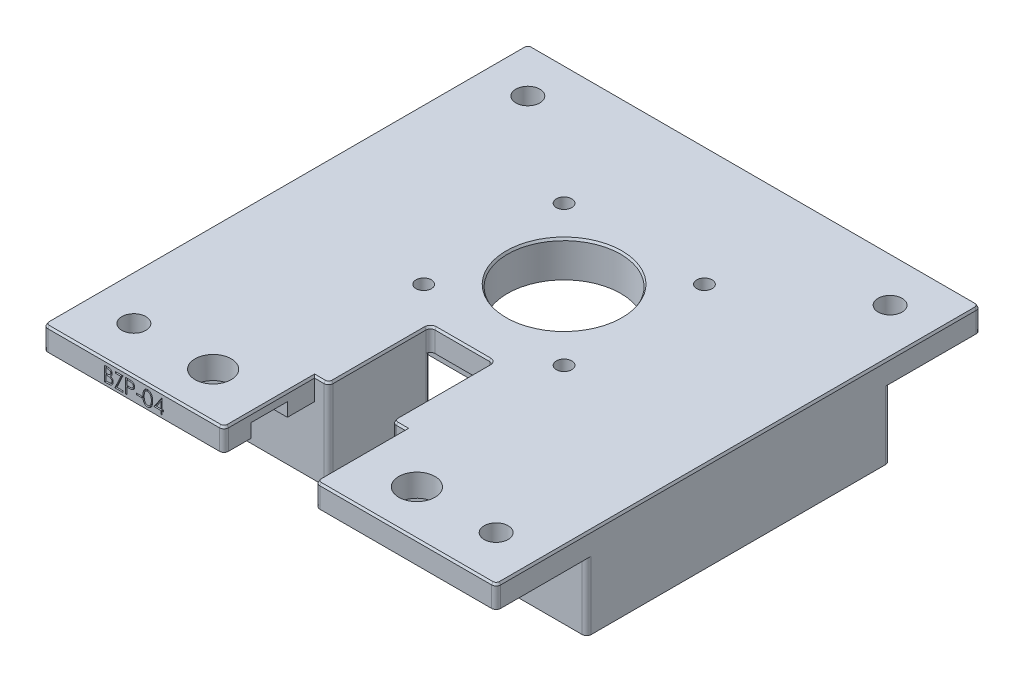
from build123d import *
from OCP.BRepFilletAPI import BRepFilletAPI_MakeChamfer
from build123d.topology import SkipClean

# Parameters (mm, degrees)
SKETCH2_W                  = 100
SKETCH2_H                  = 107
BOSS_EXTRUDE1_DEPTH        = 5
CUT_EXTRUDE1_DEPTH         = 147.540096902
CUT_EXTRUDE1_DEPTH_BACK    = 147.540096902
SKETCH3_R                  = 12.5
SKETCH3_R_2                = 1.7
SKETCH3_R_3                = 4
M5_CLEARANCE_HOLE1_D       = 5.3
FILLET1_R                  = 1
BOSS_EXTRUDE2_DEPTH        = 15
FILLET3_R                  = 3
FILLET4_R                  = 1
CUT_EXTRUDE2_DEPTH         = 4
CUT_EXTRUDE2_DEPTH_BACK    = 4
SKETCH12_R                 = 12.5
SKETCH12_R_2               = 1.7
BOSS_EXTRUDE3_DEPTH        = 3
CHAMFER2_SIZE              = 0.5
SKETCH10_W                 = 1.221153846
SKETCH10_H                 = 0.325641026
PART_NUM_DEPTH             = 0.4
PRINTABILITY_CHAMFER_SIZE  = 0.5
PRINTABILITY_CHAMFER_SIZE2 = 0.288675135


with BuildPart() as part:
    # Sketch2 → Boss-Extrude1 (new body)
    with BuildSketch(Plane(origin=(0, 0, 0), x_dir=(1, 0, 0), z_dir=(0, 1, 0))):
        with Locations((50, 53.5)):
            Rectangle(SKETCH2_W, SKETCH2_H)
    extrude(amount=BOSS_EXTRUDE1_DEPTH)

    # Sketch3 → Cut-Extrude1 (cut, two sides: drawn at the far end of the back side and taken through both)
    with BuildSketch(Plane(origin=(0, 5, 0), x_dir=(1, 0, 0), z_dir=(0, 1, 0)).offset(-CUT_EXTRUDE1_DEPTH_BACK)):
        with Locations(Location((50, 65, 0), (0, 0, 270))):
            Circle(SKETCH3_R)
        with Locations(Location((65.5, 49.5, 0), (0, 0, 270))):
            Circle(SKETCH3_R_2)
        with Locations(Location((34.5, 49.5, 0), (0, 0, 270))):
            Circle(SKETCH3_R_2)
        with Locations(Location((65.5, 80.5, 0), (0, 0, 270))):
            Circle(SKETCH3_R_2)
        with Locations(Location((34.5, 80.5, 0), (0, 0, 270))):
            Circle(SKETCH3_R_2)
        with Locations(Location((27.5, 10, 0), (0, 0, 270))):
            Circle(SKETCH3_R_3)
        with Locations(Location((72.5, 10, 0), (0, 0, 90))):
            Circle(SKETCH3_R_3)
        Polygon((39.9, 0), (39.9, 20), (43, 20), (43, 42.5), (57, 42.5), (57, 20), (60.1, 20), (60.1, 0), align=None)
    extrude(amount=CUT_EXTRUDE1_DEPTH + CUT_EXTRUDE1_DEPTH_BACK, mode=Mode.SUBTRACT)

    # M5 Clearance Hole1 (through all)
    with Locations(Plane(origin=(0, 5, 0), x_dir=(1, 0, 0), z_dir=(0, 1, 0))):
        with Locations((10, 97), (10, 10), (90, 10), (90, 97)):
            Hole(M5_CLEARANCE_HOLE1_D / 2)

    # Fillet1
    fillet1_edges = [part.edges().sort_by_distance(p)[0] for p in [
        (60.1, 2.5, 0),
        (39.9, 2.5, 0),
        (43, 2.5, -42.5),
        (57, 2.5, -42.5),
        (0, 2.5, -107),
        (100, 2.5, -107),
        (100, 2.5, 0),
        (0, 2.5, 0),
    ]]
    fillet(fillet1_edges, radius=FILLET1_R)

    # Sketch7 → Boss-Extrude2 (add)
    with BuildSketch(Plane.XZ):
        Polygon((57, -20), (100, -20), (100, -87), (84, -87), (84, -82), (95, -82), (95, -25), (62, -25), (62, -42.5), (57, -42.5), (57, -25), align=None)
        Polygon((43, -25), (43, -20), (0, -20), (0, -87), (16, -87), (16, -82), (5, -82), (5, -25), (38, -25), (38, -42.5), (43, -42.5), align=None)
    extrude(amount=BOSS_EXTRUDE2_DEPTH)

    # Fillet3
    fillet3_edges = [part.edges().sort_by_distance(p)[0] for p in [
        (62, -7.5, -25),
        (95, -7.5, -25),
        (95, -7.5, -82),
        (5, -7.5, -82),
        (5, -7.5, -25),
        (38, -7.5, -25),
    ]]
    fillet(fillet3_edges, radius=FILLET3_R)

    # Fillet4
    fillet4_edges = [part.edges().sort_by_distance(p)[0] for p in [
        (100, -7.5, -87),
        (100, -7.5, -20),
        (43, -5, -20),
        (57, -5, -20),
        (84, -7.5, -87),
        (84, -7.5, -82),
        (0, -7.5, -20),
        (0, -7.5, -87),
        (16, -7.5, -87),
        (16, -7.5, -82),
        (38, -7.5, -42.5),
        (62, -7.5, -42.5),
        (57, -7.5, -42.5),
        (43, -7.5, -42.5),
    ]]
    fillet(fillet4_edges, radius=FILLET4_R)

    # Sketch9 → Cut-Extrude2 (cut, two sides: drawn at the far end of the back side and taken through both)
    with BuildSketch(Plane.XY.offset(-10).offset(-CUT_EXTRUDE2_DEPTH_BACK)):
        Polygon((39.9, 0), (39.9, 3), (36.9, 0), align=None)
        Polygon((60.1, 0), (63.1, 0), (60.1, 3), align=None)
    extrude(amount=CUT_EXTRUDE2_DEPTH + CUT_EXTRUDE2_DEPTH_BACK, mode=Mode.SUBTRACT)

    # Sketch12 → Boss-Extrude3 (add)
    with SkipClean():  # the faces are left unmerged after this step: merging them gives an invalid solid
        with BuildSketch(Plane.XZ):
            with BuildLine():
                Line((34.5, -85.5), (65.5, -85.5))
                ThreePointArc((65.5, -85.5), (69.035533906, -84.035533906), (70.5, -80.5))
                Line((70.5, -80.5), (70.5, -49.5))
                ThreePointArc((70.5, -49.5), (69.035533906, -45.964466094), (65.5, -44.5))
                Line((65.5, -44.5), (34.5, -44.5))
                ThreePointArc((34.5, -44.5), (30.964466094, -45.964466094), (29.5, -49.5))
                Line((29.5, -49.5), (29.5, -80.5))
                ThreePointArc((29.5, -80.5), (30.964466094, -84.035533906), (34.5, -85.5))
            make_face()
            with Locations(Location((50, -65, 0), (0, 0, 270))):
                Circle(SKETCH12_R, mode=Mode.SUBTRACT)
            with Locations(Location((34.5, -49.5, 0), (0, 0, 270))):
                Circle(SKETCH12_R_2, mode=Mode.SUBTRACT)
            with Locations(Location((65.5, -49.5, 0), (0, 0, 270))):
                Circle(SKETCH12_R_2, mode=Mode.SUBTRACT)
            with Locations(Location((65.5, -80.5, 0), (0, 0, 270))):
                Circle(SKETCH12_R_2, mode=Mode.SUBTRACT)
            with Locations(Location((34.5, -80.5, 0), (0, 0, 270))):
                Circle(SKETCH12_R_2, mode=Mode.SUBTRACT)
        extrude(amount=BOSS_EXTRUDE3_DEPTH)

    # Chamfer2
    chamfer2_edges = [part.edges().sort_by_distance(p)[0] for p in [
        (69.035533906, 0, -84.035533906),
        (70.5, 0, -65),
        (69.035533906, 0, -45.964466094),
        (50, 0, -44.5),
        (30.964466094, 0, -45.964466094),
        (29.5, 0, -65),
        (30.964466094, 0, -84.035533906),
        (50, 0, -85.5),
    ]]
    chamfer(chamfer2_edges, length=CHAMFER2_SIZE)

    # Sketch10 → Part Num (cut)
    # profile 1 of 6: a face of its own
    with SkipClean():  # the faces are left unmerged after this step: merging them gives an invalid solid
        with BuildSketch(Plane(origin=(0, 5, 0), x_dir=(1, 0, 0), z_dir=(0, 0, -1))):
            with BuildLine():
                Line((13.559294872, 1.225), (14.178776042, 1.225))
                add(Edge.make_bspline(
                    [(14.178776042, 1.225), (14.209100925, 1.225156921), (14.267878096, 1.225461072), (14.353342091, 1.230287737), (14.433418884, 1.236704332), (14.50796697, 1.247467824), (14.577471422, 1.258628146), (14.641226624, 1.275008826), (14.699766605, 1.293101885), (14.77006114, 1.32094051), (14.849819923, 1.364174247), (14.93554569, 1.428293986), (15.010063757, 1.505168377), (15.073426203, 1.592772808), (15.124275913, 1.68914761), (15.160598035, 1.792219247), (15.18393275, 1.900253662), (15.186302411, 1.974321243), (15.1875, 2.011753806)],
                    knots=[0, 0, 0, 0, 1.00128172, 1.940733171, 2.826250472, 3.653024905, 4.427672124, 5.149348099, 5.824709082, 6.450061444, 7.643590664, 8.808605388, 9.972104426, 11.165284501, 12.367876273, 13.557044126, 14.765369432, 16, 16, 16, 16], degree=3))
                add(Edge.make_bspline(
                    [(15.1875, 2.011753806), (15.186521793, 2.046821674), (15.184599523, 2.115733341), (15.165820503, 2.216186738), (15.137474028, 2.312110727), (15.096568342, 2.402580893), (15.044410156, 2.486802276), (14.980951884, 2.563338275), (14.905707767, 2.630686236), (14.849214068, 2.668166335), (14.820517829, 2.687204527)],
                    knots=[0, 0, 0, 0, 1.044356178, 2.052258378, 3.035953355, 4.020338374, 5.002448483, 5.980768927, 6.974322109, 8, 8, 8, 8], degree=3))
                add(Edge.make_bspline(
                    [(14.820517829, 2.687204527), (14.856588776, 2.701045853), (14.925601434, 2.727527739), (15.020694663, 2.77452874), (15.102651573, 2.825257679), (15.172528364, 2.880086384), (15.231080178, 2.940805168), (15.283240485, 3.005814962), (15.327507334, 3.077379834), (15.365276832, 3.153949009), (15.395196276, 3.235117005), (15.415964531, 3.320276589), (15.429135825, 3.40846321), (15.430858211, 3.468399436), (15.431730769, 3.498763021)],
                    knots=[0, 0, 0, 0, 1.272200328, 2.434034374, 3.488177493, 4.442517805, 5.351202203, 6.260825393, 7.183200622, 8.11705787, 9.069326169, 10.026320267, 11.000137371, 12, 12, 12, 12], degree=3))
                add(Edge.make_bspline(
                    [(15.431730769, 3.498763021), (15.430844545, 3.529757203), (15.429100875, 3.590739126), (15.41623883, 3.680324877), (15.394454675, 3.765933729), (15.364470848, 3.848135531), (15.325385419, 3.926448851), (15.27816616, 4.001489144), (15.22149309, 4.072144303), (15.157673639, 4.13943962), (15.086469492, 4.20097828), (15.008008094, 4.253862582), (14.924300327, 4.299540927), (14.834199915, 4.336263754), (14.73834618, 4.365011011), (14.636716669, 4.384886817), (14.529369089, 4.398332925), (14.455699174, 4.399434879), (14.41791867, 4.4)],
                    knots=[0, 0, 0, 0, 0.978522333, 1.925270105, 2.85076145, 3.763600118, 4.682725947, 5.609499657, 6.557784645, 7.537954401, 8.534920712, 9.522742111, 10.520247711, 11.5409147, 12.58930695, 13.675078472, 14.807699069, 16, 16, 16, 16], degree=3))
                Line((14.41791867, 4.4), (13.559294872, 4.4))
                Line((13.559294872, 4.4), (13.559294872, 1.225))
            make_face()
            with BuildLine():
                Line((13.844230769, 1.550641026), (13.844230769, 2.568269231))
                Line((13.844230769, 2.568269231), (14.035672075, 2.568269231))
                add(Edge.make_bspline(
                    [(14.035672075, 2.568269231), (14.063656592, 2.567909462), (14.11772838, 2.567214317), (14.196240951, 2.565160292), (14.26893695, 2.559660798), (14.336066859, 2.553844164), (14.397180797, 2.544887778), (14.452483186, 2.53392756), (14.502471365, 2.522437825), (14.560090796, 2.502841292), (14.625441111, 2.474182831), (14.694618633, 2.428618136), (14.756881512, 2.375864071), (14.808244794, 2.313289506), (14.85100659, 2.245714635), (14.879796447, 2.172635549), (14.899869806, 2.096570575), (14.901656804, 2.044112234), (14.902564103, 2.017477965)],
                    knots=[0, 0, 0, 0, 1.156584208, 2.234756387, 3.244705828, 4.168772894, 5.018724976, 5.795346628, 6.498686023, 7.135894168, 8.308330183, 9.43588092, 10.547699294, 11.667188675, 12.76860303, 13.837480448, 14.902040606, 16, 16, 16, 16], degree=3))
                add(Edge.make_bspline(
                    [(14.902564103, 2.017477965), (14.902121598, 1.999845497), (14.901253578, 1.965257486), (14.893070408, 1.914864741), (14.88177773, 1.866910763), (14.863153292, 1.822688306), (14.841088146, 1.780644538), (14.8128059, 1.742107543), (14.780193868, 1.706033348), (14.742172327, 1.673388889), (14.698896699, 1.64386386), (14.648996117, 1.619285683), (14.593827254, 1.597443357), (14.532239669, 1.580886362), (14.465460128, 1.566512255), (14.392469815, 1.557448022), (14.313708618, 1.551625016), (14.259137987, 1.550976338), (14.230929487, 1.550641026)],
                    knots=[0, 0, 0, 0, 0.911412742, 1.787835618, 2.63643285, 3.453173233, 4.262886967, 5.08783453, 5.918594724, 6.773969545, 7.67442701, 8.62112486, 9.645634318, 10.739428598, 11.916091468, 13.177237585, 14.540865421, 16, 16, 16, 16], degree=3))
                Line((14.230929487, 1.550641026), (13.844230769, 1.550641026))
            make_face(mode=Mode.SUBTRACT)
            with BuildLine():
                Line((13.844230769, 2.893910256), (13.844230769, 4.074358974))
                Line((13.844230769, 4.074358974), (14.250010016, 4.074358974))
                add(Edge.make_bspline(
                    [(14.250010016, 4.074358974), (14.279052852, 4.073977387), (14.335029091, 4.073241928), (14.415910647, 4.071496784), (14.490477252, 4.065022306), (14.55934975, 4.058814977), (14.622209475, 4.048674015), (14.679667845, 4.038854064), (14.730412484, 4.024403522), (14.789786642, 4.00451932), (14.856196042, 3.97274173), (14.92871824, 3.926010062), (14.99259521, 3.869087446), (15.046790344, 3.803544285), (15.091851221, 3.733014359), (15.123024449, 3.657358853), (15.143222926, 3.579104783), (15.145601826, 3.52559752), (15.146794872, 3.498763021)],
                    knots=[0, 0, 0, 0, 1.16016216, 2.236059617, 3.229676189, 4.14889023, 4.996733752, 5.772278665, 6.474820656, 7.101410824, 8.271817372, 9.403828207, 10.537358096, 11.673541442, 12.791884111, 13.865947414, 14.929748409, 16, 16, 16, 16], degree=3))
                add(Edge.make_bspline(
                    [(15.146794872, 3.498763021), (15.146551335, 3.481984403), (15.146068189, 3.448697807), (15.138473614, 3.399825141), (15.127934288, 3.352248989), (15.11240228, 3.306615593), (15.093612775, 3.262139153), (15.06882463, 3.220266851), (15.040863787, 3.17921625), (14.997556668, 3.126707986), (14.933707118, 3.066939881), (14.842942728, 3.009154389), (14.740317485, 2.961797377), (14.665709188, 2.941777202), (14.62716847, 2.931435296)],
                    knots=[0, 0, 0, 0, 0.723354195, 1.435040621, 2.129761981, 2.824182007, 3.512608497, 4.209435533, 4.920062464, 5.654614313, 7.143585817, 8.671381114, 10.280521501, 12, 12, 12, 12], degree=3))
                add(Edge.make_bspline(
                    [(14.62716847, 2.931435296), (14.611720661, 2.928300831), (14.578226627, 2.921504664), (14.523609473, 2.914335298), (14.461047138, 2.907904144), (14.390807025, 2.903271916), (14.31260978, 2.898299301), (14.226480524, 2.896434267), (14.132358367, 2.894157894), (14.067050921, 2.893994914), (14.033128005, 2.893910256)],
                    knots=[0, 0, 0, 0, 0.634452549, 1.375623993, 2.216454381, 3.166361212, 4.209414599, 5.370755378, 6.634280627, 8, 8, 8, 8], degree=3))
                Line((14.033128005, 2.893910256), (13.844230769, 2.893910256))
            make_face(mode=Mode.SUBTRACT)
        # profile 2 of 6: a face of its own
        with BuildSketch(Plane(origin=(0, 5, 0), x_dir=(1, 0, 0), z_dir=(0, 0, -1))):
            Polygon((15.920192308, 1.550641026), (15.920192308, 1.225), (17.589102564, 1.225), (16.257281651, 4.074358974), (17.548397436, 4.074358974), (17.548397436, 4.4), (15.798076923, 4.4), (17.129897837, 1.550641026), align=None)
        # profile 3 of 6: a face of its own
        with BuildSketch(Plane(origin=(0, 5, 0), x_dir=(1, 0, 0), z_dir=(0, 0, -1))):
            with BuildLine():
                Line((18.199679487, 1.225), (18.822340745, 1.225))
                add(Edge.make_bspline(
                    [(18.822340745, 1.225), (18.865167781, 1.225047077), (18.947226285, 1.22513728), (19.064896371, 1.227872085), (19.171766628, 1.23152487), (19.267606616, 1.236588444), (19.352711219, 1.242572494), (19.426695341, 1.250965415), (19.49014051, 1.259728683), (19.528155646, 1.268638102), (19.545492788, 1.272701322)],
                    knots=[0, 0, 0, 0, 1.415646017, 2.712440637, 3.8905458, 4.950247383, 5.884950622, 6.709939814, 7.411656543, 8, 8, 8, 8], degree=3))
                add(Edge.make_bspline(
                    [(19.545492788, 1.272701322), (19.56743964, 1.278708558), (19.610816194, 1.290581476), (19.673321301, 1.314358446), (19.732780513, 1.342564145), (19.789442546, 1.374662729), (19.842336712, 1.412170044), (19.89311447, 1.452921295), (19.940710937, 1.498564559), (19.984407421, 1.549039743), (20.024894101, 1.6026933), (20.058784353, 1.660893367), (20.08871078, 1.721620959), (20.112032716, 1.78635876), (20.130364655, 1.854252238), (20.143715825, 1.9254781), (20.152296908, 1.999882695), (20.153111145, 2.050738752), (20.153525641, 2.076627604)],
                    knots=[0, 0, 0, 0, 0.999333726, 1.975119402, 2.933498163, 3.889020618, 4.832249799, 5.779334906, 6.747801194, 7.724875447, 8.710438469, 9.696133548, 10.679360639, 11.681339199, 12.714023775, 13.766351759, 14.862936069, 16, 16, 16, 16], degree=3))
                add(Edge.make_bspline(
                    [(20.153525641, 2.076627604), (20.153143349, 2.102733159), (20.152395368, 2.15381044), (20.143418023, 2.228534326), (20.131325635, 2.299943151), (20.11273188, 2.367878582), (20.08837902, 2.431937173), (20.059811229, 2.493097862), (20.025354741, 2.550320136), (19.985762645, 2.603811736), (19.941719413, 2.65362287), (19.893411391, 2.699392577), (19.841033604, 2.740852941), (19.784752512, 2.77809691), (19.724019435, 2.810260821), (19.659755482, 2.839069233), (19.591402071, 2.863263695), (19.544101362, 2.875990965), (19.520052083, 2.882461939)],
                    knots=[0, 0, 0, 0, 1.121902311, 2.195077645, 3.232258892, 4.234102512, 5.217864754, 6.176164875, 7.132989551, 8.084763148, 9.034132444, 9.988522005, 10.94243251, 11.903244335, 12.886203696, 13.894208494, 14.929344452, 16, 16, 16, 16], degree=3))
                add(Edge.make_bspline(
                    [(19.520052083, 2.882461939), (19.500160632, 2.886688777), (19.456567361, 2.895952137), (19.384778108, 2.906363894), (19.301151672, 2.914902673), (19.205972588, 2.922871129), (19.0990189, 2.927093415), (18.980535909, 2.932051068), (18.850122628, 2.934390313), (18.759163431, 2.934538182), (18.711673678, 2.934615385)],
                    knots=[0, 0, 0, 0, 0.601372724, 1.317943291, 2.144091499, 3.08771165, 4.142394186, 5.309582461, 6.595334295, 8, 8, 8, 8], degree=3))
                Line((18.711673678, 2.934615385), (18.484615385, 2.934615385))
                Line((18.484615385, 2.934615385), (18.484615385, 4.4))
                Line((18.484615385, 4.4), (18.199679487, 4.4))
                Line((18.199679487, 4.4), (18.199679487, 1.225))
            make_face()
            with BuildLine():
                Line((18.484615385, 1.550641026), (18.484615385, 2.608974359))
                Line((18.484615385, 2.608974359), (19.040494792, 2.615970553))
                add(Edge.make_bspline(
                    [(19.040494792, 2.615970553), (19.067636896, 2.61598845), (19.120034167, 2.616022999), (19.195928006, 2.61234584), (19.266170464, 2.608345506), (19.330865252, 2.601876016), (19.389717084, 2.593985255), (19.44286845, 2.583435268), (19.490743523, 2.572674962), (19.545890306, 2.554003923), (19.607660485, 2.525836289), (19.674703005, 2.483764418), (19.73198534, 2.430764439), (19.781136336, 2.370529413), (19.81998684, 2.303449897), (19.848143485, 2.231877993), (19.865329717, 2.156085468), (19.86748988, 2.104277864), (19.868589744, 2.077899639)],
                    knots=[0, 0, 0, 0, 1.160501667, 2.240324542, 3.248665471, 4.168823117, 5.020172044, 5.786515869, 6.485785279, 7.116517804, 8.272762037, 9.381837012, 10.485674779, 11.594342068, 12.695271952, 13.786226926, 14.872841088, 16, 16, 16, 16], degree=3))
                add(Edge.make_bspline(
                    [(19.868589744, 2.077899639), (19.867440811, 2.052375996), (19.865156875, 2.001638153), (19.84828545, 1.927242072), (19.819688653, 1.856483828), (19.781104663, 1.789935981), (19.733131498, 1.729861051), (19.67698839, 1.678042247), (19.613548837, 1.636100993), (19.554996767, 1.608181099), (19.502597275, 1.591808252), (19.457302681, 1.579987886), (19.405900244, 1.571835631), (19.348876426, 1.564035455), (19.286304234, 1.557739017), (19.217785787, 1.553366568), (19.143549316, 1.550834445), (19.092014254, 1.55070706), (19.065299479, 1.550641026)],
                    knots=[0, 0, 0, 0, 1.12039168, 2.227199994, 3.330242575, 4.460839274, 5.593542475, 6.693949254, 7.801736126, 8.92216649, 9.528704869, 10.210659466, 10.975987387, 11.81211542, 12.738540127, 13.736887663, 14.826846554, 16, 16, 16, 16], degree=3))
                Line((19.065299479, 1.550641026), (18.484615385, 1.550641026))
            make_face(mode=Mode.SUBTRACT)
        # profile 4 of 6: a face of its own
        with BuildSketch(Plane(origin=(0, 5, 0), x_dir=(1, 0, 0), z_dir=(0, 0, -1))):
            with Locations((21.130448718, 3.178846154)):
                Rectangle(SKETCH10_W, SKETCH10_H)
        # profile 5 of 6: a face of its own
        with BuildSketch(Plane(origin=(0, 5, 0), x_dir=(1, 0, 0), z_dir=(0, 0, -1))):
            with BuildLine():
                add(Edge.make_bspline(
                    [(21.98525641, 2.813772035), (21.98555397, 2.762883691), (21.986131983, 2.664032348), (21.992562193, 2.519991994), (22.00324411, 2.384863731), (22.017883016, 2.258641095), (22.035697459, 2.141291485), (22.059478684, 2.033128559), (22.086523044, 1.933651525), (22.117867421, 1.842536591), (22.153233633, 1.758554174), (22.191732091, 1.680158454), (22.234864124, 1.607443081), (22.280257631, 1.539336681), (22.329501301, 1.476524658), (22.382423887, 1.419289299), (22.438559244, 1.366743659), (22.498172988, 1.319751782), (22.560696927, 1.278804629), (22.62428152, 1.241686961), (22.69074033, 1.212325862), (22.758434115, 1.187218741), (22.827908268, 1.167330508), (22.899193054, 1.15349668), (22.97235244, 1.144841944), (23.021728688, 1.144011104), (23.046769832, 1.143589744)],
                    knots=[0, 0, 0, 0, 1.64625301, 3.197870201, 4.6634513, 6.030635694, 7.308242971, 8.501545196, 9.611429483, 10.641742253, 11.616230371, 12.55791849, 13.464870342, 14.34944951, 15.20427819, 16.044004467, 16.869007726, 17.689551165, 18.496129964, 19.285613293, 20.0683943, 20.843080271, 21.620342827, 22.403213977, 23.190190624, 24, 24, 24, 24], degree=3))
                add(Edge.make_bspline(
                    [(23.046769832, 1.143589744), (23.072032833, 1.143940127), (23.122297314, 1.144637268), (23.196342984, 1.15444994), (23.269098905, 1.16711544), (23.339461226, 1.187428816), (23.408760362, 1.211736404), (23.475272984, 1.243809882), (23.541347339, 1.278692279), (23.603981757, 1.321245869), (23.665047641, 1.368274589), (23.722290531, 1.421664209), (23.777173708, 1.479937166), (23.827624258, 1.544393116), (23.875804419, 1.61404376), (23.919885225, 1.68947297), (23.960783476, 1.770513584), (23.99926795, 1.856789911), (24.032921607, 1.950606524), (24.062842398, 2.051378265), (24.087367548, 2.16001767), (24.107649417, 2.275919549), (24.123392008, 2.399658079), (24.134849199, 2.530982551), (24.140903329, 2.669975122), (24.142043239, 2.765005487), (24.142628205, 2.813772035)],
                    knots=[0, 0, 0, 0, 0.810910589, 1.61342667, 2.396193133, 3.181089899, 3.963115317, 4.752255436, 5.550715454, 6.36105385, 7.181178335, 8.024612154, 8.872680183, 9.750181803, 10.651284446, 11.591556747, 12.554036451, 13.566402641, 14.62422919, 15.753422176, 16.94128843, 18.199818041, 19.531985927, 20.947085226, 22.433341622, 24, 24, 24, 24], degree=3))
                add(Edge.make_bspline(
                    [(24.142628205, 2.813772035), (24.142029642, 2.86232526), (24.140860754, 2.957141006), (24.134986983, 3.0955172), (24.123084878, 3.226125067), (24.108578365, 3.349153833), (24.087662811, 3.46444268), (24.06437755, 3.572610751), (24.034675892, 3.672641678), (24.001820493, 3.765654117), (23.963871504, 3.851564969), (23.923281266, 3.932271074), (23.878542433, 4.007272206), (23.831286761, 4.077364331), (23.779881082, 4.141267492), (23.725740637, 4.200192302), (23.667942403, 4.253674679), (23.606562168, 4.301258682), (23.543335742, 4.344132824), (23.477248506, 4.380259022), (23.409847501, 4.411753694), (23.34043167, 4.437071727), (23.269443657, 4.457085732), (23.196627822, 4.470710162), (23.122287411, 4.48031367), (23.072029521, 4.481043462), (23.046769832, 4.481410256)],
                    knots=[0, 0, 0, 0, 1.561431216, 3.049195289, 4.452146966, 5.778046447, 7.031138842, 8.218704273, 9.334037798, 10.384210803, 11.388620812, 12.352076869, 13.287433199, 14.19507451, 15.06813243, 15.922055533, 16.766344942, 17.596869952, 18.417486629, 19.220035357, 20.016159057, 20.807716045, 21.59340902, 22.384936649, 23.188266813, 24, 24, 24, 24], degree=3))
                add(Edge.make_bspline(
                    [(23.046769832, 4.481410256), (23.021729561, 4.480985162), (22.972355034, 4.480146959), (22.899183041, 4.471546161), (22.828001615, 4.457521158), (22.758668454, 4.438475275), (22.691041682, 4.414269078), (22.625783708, 4.383479729), (22.562032943, 4.347768738), (22.500079347, 4.307141318), (22.441107289, 4.260581379), (22.384765226, 4.209094936), (22.332527872, 4.151355125), (22.283623806, 4.088283519), (22.237853656, 4.020005674), (22.194904275, 3.946733625), (22.156523059, 3.867574197), (22.120354959, 3.783135875), (22.088472503, 3.691351453), (22.060633331, 3.591533526), (22.037162377, 3.483001243), (22.018467433, 3.365749411), (22.003152106, 3.239959542), (21.992572724, 3.105431183), (21.986135198, 2.962452483), (21.985554685, 2.864236572), (21.98525641, 2.813772035)],
                    knots=[0, 0, 0, 0, 0.810976328, 1.599087026, 2.383086309, 3.159618043, 3.926613167, 4.707144544, 5.494386734, 6.292609454, 7.104690378, 7.92621526, 8.762510248, 9.62398222, 10.509836085, 11.424023232, 12.373226806, 13.358118208, 14.398657954, 15.5185989, 16.713620699, 17.994156382, 19.364120462, 20.818119981, 22.365111093, 24, 24, 24, 24], degree=3))
            make_face()
            with BuildLine():
                add(Edge.make_bspline(
                    [(22.270192308, 2.8125), (22.270303039, 2.854907579), (22.270517947, 2.937212362), (22.275969792, 3.056603995), (22.283558203, 3.168147672), (22.293104865, 3.271799855), (22.307402335, 3.367198295), (22.323623727, 3.454739556), (22.343080171, 3.534261741), (22.366214564, 3.606459314), (22.392565497, 3.672356193), (22.421290351, 3.733703321), (22.452405577, 3.791246897), (22.486625049, 3.844779303), (22.524439036, 3.894001546), (22.565003515, 3.939147401), (22.608554357, 3.980033045), (22.668828635, 4.02855602), (22.748014823, 4.079288538), (22.848296213, 4.122923324), (22.95138528, 4.150522248), (23.021375705, 4.154022264), (23.056310096, 4.155769231)],
                    knots=[0, 0, 0, 0, 1.459193451, 2.832007961, 4.111736495, 5.306635028, 6.412683014, 7.430020708, 8.369596877, 9.227877302, 10.036669781, 10.810175692, 11.557788084, 12.286326232, 12.994037279, 13.69140682, 14.37267704, 15.047194847, 16.352618509, 17.594157723, 18.799169539, 20, 20, 20, 20], degree=3))
                add(Edge.make_bspline(
                    [(23.056310096, 4.155769231), (23.091445086, 4.15423738), (23.161590435, 4.151179113), (23.264609334, 4.124487765), (23.363793146, 4.081096109), (23.44206796, 4.031522171), (23.501452796, 3.984009028), (23.544016751, 3.943546211), (23.583079196, 3.898226589), (23.620129066, 3.849332926), (23.654109723, 3.795926979), (23.685009876, 3.738266698), (23.713206907, 3.676191642), (23.729271542, 3.632857667), (23.737484976, 3.610702123)],
                    knots=[0, 0, 0, 0, 1.353621445, 2.702441307, 4.075953605, 5.516772412, 6.261413105, 7.007624062, 7.778524365, 8.566925914, 9.372323995, 10.217594641, 11.088702136, 12, 12, 12, 12], degree=3))
                add(Edge.make_bspline(
                    [(23.737484976, 3.610702123), (23.747056937, 3.582372288), (23.766492122, 3.524850574), (23.791539946, 3.435620689), (23.81126613, 3.342001039), (23.829012897, 3.244551112), (23.841126026, 3.14255224), (23.850875828, 3.03632002), (23.856618666, 2.925774356), (23.857330547, 2.850667471), (23.857692308, 2.8125)],
                    knots=[0, 0, 0, 0, 0.884706709, 1.796334032, 2.740027952, 3.714592787, 4.726048262, 5.777819803, 6.87074269, 8, 8, 8, 8], degree=3))
                add(Edge.make_bspline(
                    [(23.857692308, 2.8125), (23.857293324, 2.774333349), (23.856512731, 2.699661985), (23.851384165, 2.590417712), (23.843142984, 2.486477881), (23.831988727, 2.3877482), (23.816676293, 2.294404394), (23.798287574, 2.206312902), (23.776728944, 2.12349743), (23.752000438, 2.045744551), (23.724132152, 1.973333218), (23.693344682, 1.906107553), (23.66049502, 1.843704976), (23.624792036, 1.786326202), (23.586740867, 1.733636423), (23.544975229, 1.686848523), (23.502148043, 1.643686402), (23.441238722, 1.595298485), (23.362146126, 1.54557191), (23.263049334, 1.501055337), (23.160488426, 1.474709227), (23.091011168, 1.471055605), (23.056310096, 1.469230769)],
                    knots=[0, 0, 0, 0, 1.313528337, 2.569860077, 3.762944266, 4.901481389, 5.988248151, 7.017139294, 7.997571128, 8.932104357, 9.823695246, 10.66607014, 11.475539426, 12.248954257, 12.990316782, 13.708962568, 14.405488541, 15.08007697, 16.381737273, 17.610043218, 18.806313575, 20, 20, 20, 20], degree=3))
                add(Edge.make_bspline(
                    [(23.056310096, 1.469230769), (23.021187248, 1.471057764), (22.950877566, 1.474715083), (22.847243755, 1.500962383), (22.747553725, 1.545255295), (22.668627803, 1.595359976), (22.608575961, 1.643498484), (22.565841998, 1.684583683), (22.525512289, 1.72930733), (22.487879452, 1.778306398), (22.453868763, 1.831736727), (22.422375361, 1.888863145), (22.393879682, 1.950119145), (22.367429284, 2.015979603), (22.34454036, 2.08829581), (22.323960549, 2.167802136), (22.308076031, 2.255912716), (22.293971975, 2.351759147), (22.283310912, 2.455534565), (22.276022679, 2.567342293), (22.270501389, 2.687150117), (22.270297398, 2.769879843), (22.270192308, 2.8125)],
                    knots=[0, 0, 0, 0, 1.207779899, 2.417760083, 3.652287919, 4.947299644, 5.621638849, 6.297435916, 6.984320042, 7.691843698, 8.42018894, 9.161205785, 9.934506883, 10.743085206, 11.601138371, 12.542248028, 13.566483018, 14.679455109, 15.87477181, 17.154161492, 18.533899613, 20, 20, 20, 20], degree=3))
            make_face(mode=Mode.SUBTRACT)
        # profile 6 of 6: a face of its own
        with BuildSketch(Plane(origin=(0, 5, 0), x_dir=(1, 0, 0), z_dir=(0, 0, -1))):
            Polygon((26.160712139, 1.143589744), (26.218589744, 1.143589744), (26.218589744, 3.341666667), (26.584935897, 3.341666667), (26.584935897, 3.667307692), (26.218589744, 3.667307692), (26.218589744, 4.4), (25.933653846, 4.4), (25.933653846, 3.667307692), (24.427564103, 3.667307692), align=None)
            Polygon((25.933653846, 3.341666667), (25.933653846, 1.962780449), (24.987259615, 3.341666667), align=None, mode=Mode.SUBTRACT)
        extrude(amount=PART_NUM_DEPTH, mode=Mode.SUBTRACT)

    # Printability Chamfer: one chamfer whose edges measure the first distance from different faces: ONE call of the kernel's chamfer builder (chamfer() names one face for all edges)
    printability_chamfer_edges_1 = [part.edges().sort_by_distance(p)[0] for p in [
        (50, 5, -42.5),
    ]]
    printability_chamfer_side_1 = [part.faces().sort_by_distance(p)[0] for p in [
        (50, 2.5, -42.5),
    ]]
    printability_chamfer_edges_2 = [part.edges().sort_by_distance(p)[0] for p in [
        (57, 5, -31.25),
    ]]
    printability_chamfer_side_2 = [part.faces().sort_by_distance(p)[0] for p in [
        (57, -5, -31.25),
    ]]
    printability_chamfer_edges_3 = [part.edges().sort_by_distance(p)[0] for p in [
        (19.95, 5, 0),
    ]]
    printability_chamfer_side_3 = [part.faces().sort_by_distance(p)[0] for p in [
        (19.95, 0.382283928, 0),
    ]]
    printability_chamfer_edges_4 = [part.edges().sort_by_distance(p)[0] for p in [
        (39.9, 5, -10.5),
    ]]
    printability_chamfer_side_4 = [part.faces().sort_by_distance(p)[0] for p in [
        (39.9, 2.5, -19.803531173),
    ]]
    printability_chamfer_edges_5 = [part.edges().sort_by_distance(p)[0] for p in [
        (80.05, 5, 0),
    ]]
    printability_chamfer_side_5 = [part.faces().sort_by_distance(p)[0] for p in [
        (80.05, 2.5, 0),
    ]]
    printability_chamfer_edges_6 = [part.edges().sort_by_distance(p)[0] for p in [
        (100, 5, -53.5),
    ]]
    printability_chamfer_side_6 = [part.faces().sort_by_distance(p)[0] for p in [
        (100, -4, -53.5),
    ]]
    printability_chamfer_edges_7 = [part.edges().sort_by_distance(p)[0] for p in [
        (50, 5, -107),
    ]]
    printability_chamfer_side_7 = [part.faces().sort_by_distance(p)[0] for p in [
        (50, 2.5, -107),
    ]]
    printability_chamfer_edges_8 = [part.edges().sort_by_distance(p)[0] for p in [
        (0, 5, -53.5),
    ]]
    printability_chamfer_side_8 = [part.faces().sort_by_distance(p)[0] for p in [
        (0, -4, -53.5),
    ]]
    printability_chamfer_edges_9 = [part.edges().sort_by_distance(p)[0] for p in [
        (0.292893219, 5, -0.292893219),
    ]]
    printability_chamfer_side_9 = [part.faces().sort_by_distance(p)[0] for p in [
        (0.292893219, 2.5, -0.292893219),
    ]]
    printability_chamfer_edges_10 = [part.edges().sort_by_distance(p)[0] for p in [
        (99.707106781, 5, -0.292893219),
    ]]
    printability_chamfer_side_10 = [part.faces().sort_by_distance(p)[0] for p in [
        (99.707106781, 2.5, -0.292893219),
    ]]
    printability_chamfer_edges_11 = [part.edges().sort_by_distance(p)[0] for p in [
        (99.707106781, 5, -106.707106781),
    ]]
    printability_chamfer_side_11 = [part.faces().sort_by_distance(p)[0] for p in [
        (99.707106781, 2.5, -106.707106781),
    ]]
    printability_chamfer_edges_12 = [part.edges().sort_by_distance(p)[0] for p in [
        (0.292893219, 5, -106.707106781),
    ]]
    printability_chamfer_side_12 = [part.faces().sort_by_distance(p)[0] for p in [
        (0.292893219, 2.5, -106.707106781),
    ]]
    printability_chamfer_edges_13 = [part.edges().sort_by_distance(p)[0] for p in [
        (39.607106781, 5, -0.292893219),
    ]]
    printability_chamfer_side_13 = [part.faces().sort_by_distance(p)[0] for p in [
        (39.607106781, 2.5, -0.292893219),
    ]]
    printability_chamfer_edges_14 = [part.edges().sort_by_distance(p)[0] for p in [
        (60.392893219, 5, -0.292893219),
    ]]
    printability_chamfer_side_14 = [part.faces().sort_by_distance(p)[0] for p in [
        (60.392893219, 2.5, -0.292893219),
    ]]
    printability_chamfer_edges_15 = [part.edges().sort_by_distance(p)[0] for p in [
        (56.707106781, 5, -42.207106781),
    ]]
    printability_chamfer_side_15 = [part.faces().sort_by_distance(p)[0] for p in [
        (56.707106781, 2.5, -42.207106781),
    ]]
    printability_chamfer_edges_16 = [part.edges().sort_by_distance(p)[0] for p in [
        (43.292893219, 5, -42.207106781),
    ]]
    printability_chamfer_side_16 = [part.faces().sort_by_distance(p)[0] for p in [
        (43.292893219, 2.5, -42.207106781),
    ]]
    printability_chamfer_edges_17 = [part.edges().sort_by_distance(p)[0] for p in [
        (43, 5, -31.25),
    ]]
    printability_chamfer_side_17 = [part.faces().sort_by_distance(p)[0] for p in [
        (43, -5, -31.25),
    ]]
    printability_chamfer_edges_18 = [part.edges().sort_by_distance(p)[0] for p in [
        (59.05, 5, -20),
    ]]
    printability_chamfer_side_18 = [part.faces().sort_by_distance(p)[0] for p in [
        (78.173501199, -7.332134293, -20),
    ]]
    printability_chamfer_edges_19 = [part.edges().sort_by_distance(p)[0] for p in [
        (57.292893219, 5, -20.292893219),
    ]]
    printability_chamfer_side_19 = [part.faces().sort_by_distance(p)[0] for p in [
        (57.292893219, -5, -20.292893219),
    ]]
    printability_chamfer_edges_20 = [part.edges().sort_by_distance(p)[0] for p in [
        (42.707106781, 5, -20.292893219),
    ]]
    printability_chamfer_side_20 = [part.faces().sort_by_distance(p)[0] for p in [
        (42.707106781, -5, -20.292893219),
    ]]
    printability_chamfer_edges_21 = [part.edges().sort_by_distance(p)[0] for p in [
        (50, 5, -77.5),
    ]]
    printability_chamfer_side_21 = [part.faces().sort_by_distance(p)[0] for p in [
        (50, 2.5, -77.5),
    ]]
    printability_chamfer_edges_22 = [part.edges().sort_by_distance(p)[0] for p in [
        (40.95, 5, -20),
    ]]
    printability_chamfer_side_22 = [part.faces().sort_by_distance(p)[0] for p in [
        (21.826498801, -7.332134293, -20),
    ]]
    printability_chamfer_edges_23 = [part.edges().sort_by_distance(p)[0] for p in [
        (60.1, 5, -10.5),
    ]]
    printability_chamfer_side_23 = [part.faces().sort_by_distance(p)[0] for p in [
        (60.1, 2.5, -1.196468827),
    ]]
    printability_chamfer = BRepFilletAPI_MakeChamfer(part.part.solid().wrapped)
    for e in printability_chamfer_edges_1:
        printability_chamfer.Add(PRINTABILITY_CHAMFER_SIZE, PRINTABILITY_CHAMFER_SIZE2, e.wrapped, printability_chamfer_side_1[0].wrapped)  # the first distance lies on this face
    for e in printability_chamfer_edges_2:
        printability_chamfer.Add(PRINTABILITY_CHAMFER_SIZE, PRINTABILITY_CHAMFER_SIZE2, e.wrapped, printability_chamfer_side_2[0].wrapped)  # the first distance lies on this face
    for e in printability_chamfer_edges_3:
        printability_chamfer.Add(PRINTABILITY_CHAMFER_SIZE, PRINTABILITY_CHAMFER_SIZE2, e.wrapped, printability_chamfer_side_3[0].wrapped)  # the first distance lies on this face
    for e in printability_chamfer_edges_4:
        printability_chamfer.Add(PRINTABILITY_CHAMFER_SIZE, PRINTABILITY_CHAMFER_SIZE2, e.wrapped, printability_chamfer_side_4[0].wrapped)  # the first distance lies on this face
    for e in printability_chamfer_edges_5:
        printability_chamfer.Add(PRINTABILITY_CHAMFER_SIZE, PRINTABILITY_CHAMFER_SIZE2, e.wrapped, printability_chamfer_side_5[0].wrapped)  # the first distance lies on this face
    for e in printability_chamfer_edges_6:
        printability_chamfer.Add(PRINTABILITY_CHAMFER_SIZE, PRINTABILITY_CHAMFER_SIZE2, e.wrapped, printability_chamfer_side_6[0].wrapped)  # the first distance lies on this face
    for e in printability_chamfer_edges_7:
        printability_chamfer.Add(PRINTABILITY_CHAMFER_SIZE, PRINTABILITY_CHAMFER_SIZE2, e.wrapped, printability_chamfer_side_7[0].wrapped)  # the first distance lies on this face
    for e in printability_chamfer_edges_8:
        printability_chamfer.Add(PRINTABILITY_CHAMFER_SIZE, PRINTABILITY_CHAMFER_SIZE2, e.wrapped, printability_chamfer_side_8[0].wrapped)  # the first distance lies on this face
    for e in printability_chamfer_edges_9:
        printability_chamfer.Add(PRINTABILITY_CHAMFER_SIZE, PRINTABILITY_CHAMFER_SIZE2, e.wrapped, printability_chamfer_side_9[0].wrapped)  # the first distance lies on this face
    for e in printability_chamfer_edges_10:
        printability_chamfer.Add(PRINTABILITY_CHAMFER_SIZE, PRINTABILITY_CHAMFER_SIZE2, e.wrapped, printability_chamfer_side_10[0].wrapped)  # the first distance lies on this face
    for e in printability_chamfer_edges_11:
        printability_chamfer.Add(PRINTABILITY_CHAMFER_SIZE, PRINTABILITY_CHAMFER_SIZE2, e.wrapped, printability_chamfer_side_11[0].wrapped)  # the first distance lies on this face
    for e in printability_chamfer_edges_12:
        printability_chamfer.Add(PRINTABILITY_CHAMFER_SIZE, PRINTABILITY_CHAMFER_SIZE2, e.wrapped, printability_chamfer_side_12[0].wrapped)  # the first distance lies on this face
    for e in printability_chamfer_edges_13:
        printability_chamfer.Add(PRINTABILITY_CHAMFER_SIZE, PRINTABILITY_CHAMFER_SIZE2, e.wrapped, printability_chamfer_side_13[0].wrapped)  # the first distance lies on this face
    for e in printability_chamfer_edges_14:
        printability_chamfer.Add(PRINTABILITY_CHAMFER_SIZE, PRINTABILITY_CHAMFER_SIZE2, e.wrapped, printability_chamfer_side_14[0].wrapped)  # the first distance lies on this face
    for e in printability_chamfer_edges_15:
        printability_chamfer.Add(PRINTABILITY_CHAMFER_SIZE, PRINTABILITY_CHAMFER_SIZE2, e.wrapped, printability_chamfer_side_15[0].wrapped)  # the first distance lies on this face
    for e in printability_chamfer_edges_16:
        printability_chamfer.Add(PRINTABILITY_CHAMFER_SIZE, PRINTABILITY_CHAMFER_SIZE2, e.wrapped, printability_chamfer_side_16[0].wrapped)  # the first distance lies on this face
    for e in printability_chamfer_edges_17:
        printability_chamfer.Add(PRINTABILITY_CHAMFER_SIZE, PRINTABILITY_CHAMFER_SIZE2, e.wrapped, printability_chamfer_side_17[0].wrapped)  # the first distance lies on this face
    for e in printability_chamfer_edges_18:
        printability_chamfer.Add(PRINTABILITY_CHAMFER_SIZE, PRINTABILITY_CHAMFER_SIZE2, e.wrapped, printability_chamfer_side_18[0].wrapped)  # the first distance lies on this face
    for e in printability_chamfer_edges_19:
        printability_chamfer.Add(PRINTABILITY_CHAMFER_SIZE, PRINTABILITY_CHAMFER_SIZE2, e.wrapped, printability_chamfer_side_19[0].wrapped)  # the first distance lies on this face
    for e in printability_chamfer_edges_20:
        printability_chamfer.Add(PRINTABILITY_CHAMFER_SIZE, PRINTABILITY_CHAMFER_SIZE2, e.wrapped, printability_chamfer_side_20[0].wrapped)  # the first distance lies on this face
    for e in printability_chamfer_edges_21:
        printability_chamfer.Add(PRINTABILITY_CHAMFER_SIZE, PRINTABILITY_CHAMFER_SIZE2, e.wrapped, printability_chamfer_side_21[0].wrapped)  # the first distance lies on this face
    for e in printability_chamfer_edges_22:
        printability_chamfer.Add(PRINTABILITY_CHAMFER_SIZE, PRINTABILITY_CHAMFER_SIZE2, e.wrapped, printability_chamfer_side_22[0].wrapped)  # the first distance lies on this face
    for e in printability_chamfer_edges_23:
        printability_chamfer.Add(PRINTABILITY_CHAMFER_SIZE, PRINTABILITY_CHAMFER_SIZE2, e.wrapped, printability_chamfer_side_23[0].wrapped)  # the first distance lies on this face
    add(Compound.cast(printability_chamfer.Shape()), mode=Mode.REPLACE)


solid = part.part
